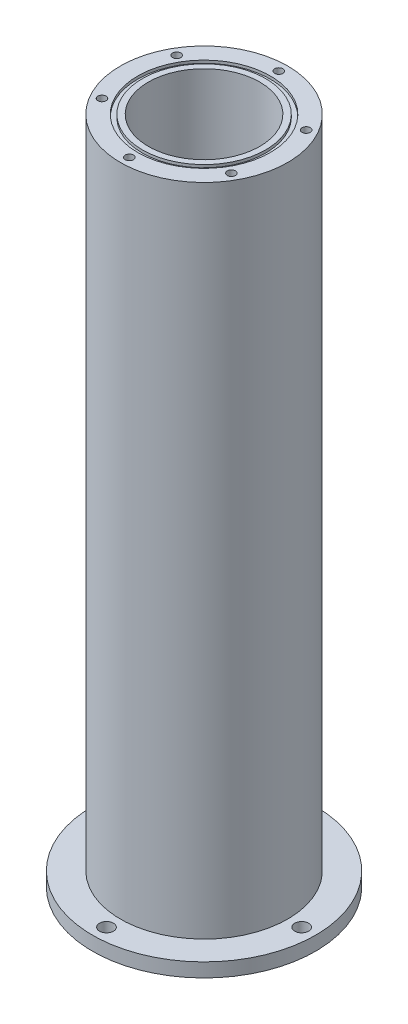
from build123d import *

# Parameters (mm, degrees)
SKETCH1_R                        = 38.1
SKETCH1_R_2                      = 25.4
BOSS_EXTRUDE1_DEPTH              = 304.8
SKETCH2_R                        = 50.8
SKETCH2_R_2                      = 38.1
BOSS_EXTRUDE2_DEPTH              = 6.35
F_1_4_0_25_DIAMETER_HOLE1_D      = 6.35
SKETCH5_R                        = 28.6385
CUT_EXTRUDE1_DEPTH               = 6.477
SKETCH6_R                        = 30.2133
SKETCH6_R_2                      = 28.1051
CUT_EXTRUDE2_DEPTH               = 1.27
TAPPED_HOLE_FOR_6_32_HELICOIL1_D = 3.7338
CIRPATTERN1_COUNT                = 6


with BuildPart() as part:
    # Sketch1 → Boss-Extrude1 (new body)
    with BuildSketch(Plane(origin=(0, 0, 0), x_dir=(1, 0, 0), z_dir=(0, 1, 0))):
        with Locations(Location((0, 0, 0), (0, 0, 90))):
            Circle(SKETCH1_R)
        with Locations(Location((0, 0, 0), (0, 0, 90))):
            Circle(SKETCH1_R_2, mode=Mode.SUBTRACT)
    extrude(amount=BOSS_EXTRUDE1_DEPTH)

    # Sketch2 → Boss-Extrude2 (add)
    with BuildSketch(Plane(origin=(0, 0, 0), x_dir=(-1, 0, 0), z_dir=(0, -1, 0))):
        with Locations(Location((0, 0, 0), (0, 0, 90))):
            Circle(SKETCH2_R)
        with Locations(Location((0, 0, 0), (0, 0, 90))):
            Circle(SKETCH2_R_2, mode=Mode.SUBTRACT)
    extrude(amount=-BOSS_EXTRUDE2_DEPTH)

    # 1/4 (0.25) Diameter Hole1 (through all)
    with Locations(Plane(origin=(0, 0, 0), x_dir=(-1, 0, 0), z_dir=(0, -1, 0))):
        with Locations((0, -44.45), (-44.45, 0), (0, 44.45), (44.45, 0)):
            Hole(F_1_4_0_25_DIAMETER_HOLE1_D / 2)

    # Sketch5 → Cut-Extrude1 (cut)
    with BuildSketch(Plane(origin=(0, 0, 0), x_dir=(-1, 0, 0), z_dir=(0, -1, 0))):
        with Locations(Location((0, 0, 0), (0, 0, 90))):
            Circle(SKETCH5_R)
    extrude(amount=-CUT_EXTRUDE1_DEPTH, mode=Mode.SUBTRACT)

    # Sketch6 → Cut-Extrude2 (cut)
    with BuildSketch(Plane(origin=(0, 304.8, 0), x_dir=(1, 0, 0), z_dir=(0, 1, 0))):
        with Locations(Location((0, 0, 0), (0, 0, 270))):
            Circle(SKETCH6_R)
        with Locations(Location((0, 0, 0), (0, 0, 270))):
            Circle(SKETCH6_R_2, mode=Mode.SUBTRACT)
    extrude(amount=-CUT_EXTRUDE2_DEPTH, mode=Mode.SUBTRACT)

    # Tapped Hole for #6-32 Helicoil1 (through all)
    with Locations(Plane(origin=(0, 304.8, 0), x_dir=(1, 0, 0), z_dir=(0, 1, 0))):
        with Locations((0, 34.036)):
            tapped_hole_for_6_32_helicoil1 = Hole(TAPPED_HOLE_FOR_6_32_HELICOIL1_D / 2)

    # CirPattern1: Tapped Hole for #6-32 Helicoil1 ×6 about axis
    cirpattern1_axis = Axis((0, 0, 0), (0, 1, 0))
    for i in range(1, CIRPATTERN1_COUNT):
        add(tapped_hole_for_6_32_helicoil1.rotate(cirpattern1_axis, i * 360 / CIRPATTERN1_COUNT), mode=Mode.SUBTRACT)


solid = part.part
